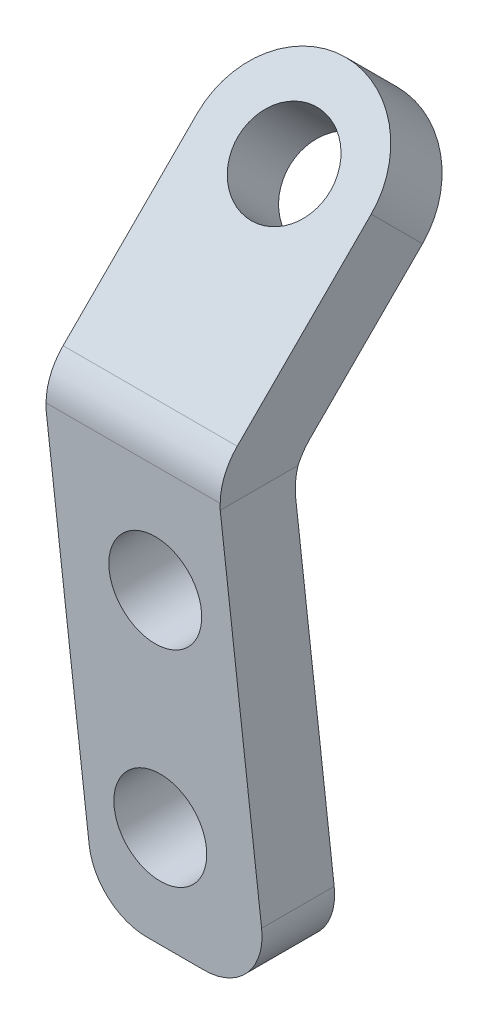
from build123d import *

# Parameters (mm, degrees)
SKETCH_4_R           = 4.196960071
EXTRUDE_3_DEPTH      = 0.6
EXTRUDE_START        = 0.6
SKETCH_5_R           = 4.196960071
EXTRUDE_4_DEPTH      = 0.6
SKETCH_8_R           = 1.6
EXTRUDE_6_DEPTH      = 2.5
SKETCH_9_R           = 27.5
EXTRUDE_7_DEPTH      = 2.5
SKETCH_10_W          = 6
SKETCH_10_H          = 20
CUT_EXTRUDE_1_DEPTH  = 49.812552895
CUT_EXTRUDE_8_DEPTH  = 49.812552895
CUT_EXTRUDE_9_DEPTH  = 6
CUT_EXTRUDE_START    = -31.2
SKETCH_19_R          = 4.196960071
CUT_EXTRUDE_10_DEPTH = 31.2
SKETCH_20_R          = 1.6
CUT_EXTRUDE_11_DEPTH = 40.445330411
FILLET_1_R           = 2


with BuildPart() as part:
    # ｽｹｯﾁ1 → 回転1 (revolve)
    with BuildSketch(Plane(origin=(0, 0, 0), x_dir=(1, 0, 0), z_dir=(0, -0.7071067811865488, 0.7071067811865464)), mode=Mode.PRIVATE) as revolve_1_sk:
        with BuildLine():
            Line((-22.696960071, 15), (-18.5, 15))
            Line((-18.5, 15), (-18.5, -15))
            Line((-18.5, -15), (-22.696960071, -15))
            ThreePointArc((-22.696960071, -15), (-25, 0), (-22.696960071, 15))
        make_face()
    revolve(revolve_1_sk.sketch.rotate(Axis((-18.5, 17.67766953, 17.67766953), (0, -0.7071067811865462, -0.7071067811865488)), 270), axis=Axis((-18.5, 17.67766953, 17.67766953), (0, -0.7071067811865462, -0.7071067811865488)))

    # ｽｹｯﾁ4 → ﾎﾞｽ - 押し出し3 (add)
    with BuildSketch(Plane(origin=(0, -10.606601718, -10.606601718), x_dir=(1, 0, 0), z_dir=(0, -0.7071067811865462, -0.7071067811865488))):
        with Locations(Location((-18.5, 0, 0), (0, 0, 90))):
            Circle(SKETCH_4_R)
    extrude(amount=EXTRUDE_3_DEPTH)

    # ｽｹｯﾁ5 → ﾎﾞｽ - 押し出し4 (add)
    with BuildSketch(Plane(origin=(0, 10.606601718, 10.606601718), x_dir=(1, 0, 0), z_dir=(0, 0.7071067811865462, 0.7071067811865488)).offset(EXTRUDE_START)):
        with Locations(Location((-18.5, 0, 0), (0, 0, 270))):
            Circle(SKETCH_5_R)
    extrude(amount=-EXTRUDE_4_DEPTH)

    # ｽｹｯﾁ8 → ﾎﾞｽ - 押し出し6 (add)
    with BuildSketch(Plane(origin=(0, 11.030865787, 11.030865787), x_dir=(1, 0, 0), z_dir=(0, 0.7071067811865462, 0.7071067811865488))):
        with BuildLine():
            Line((-15.5, -9.999999662), (-21.5, -9.999999662))
            Line((-21.5, -9.999999662), (-21.5, 3.38e-07))
            ThreePointArc((-21.5, 3.38e-07), (-18.5, 3), (-15.5, 3.38e-07))
            Line((-15.5, 3.38e-07), (-15.5, -9.999999662))
        make_face()
        with Locations(Location((-18.5, 0, 0), (0, 0, 270))):
            Circle(SKETCH_8_R, mode=Mode.SUBTRACT)
    extrude(amount=EXTRUDE_6_DEPTH)

    # ｽｹｯﾁ9 → ﾎﾞｽ - 押し出し7 (add)
    with BuildSketch(Plane.XY.offset(18)):
        Circle(SKETCH_9_R)
    extrude(amount=-EXTRUDE_7_DEPTH)

    # ｽｹｯﾁ10 → ｶｯﾄ - 押し出し1 (cut, through all)
    with BuildSketch(Plane(origin=(0, 0, 15.5), x_dir=(-1, 0, 0), z_dir=(0, 0, -1))):
        with Locations((24.5, 0.097265479)):
            Rectangle(SKETCH_10_W, SKETCH_10_H)
    extrude(amount=-CUT_EXTRUDE_1_DEPTH, mode=Mode.SUBTRACT)

    # ｽｹｯﾁ16 → ｶｯﾄ - 押し出し8 (cut, through all)
    with BuildSketch(Plane(origin=(0, 0, 15.5), x_dir=(-1, 0, 0), z_dir=(0, 0, -1))):
        with BuildLine():
            Line((25.579195254, 10.097265479), (15.5, 10.097265479))
            Line((15.5, 10.097265479), (15.5, 22.715633383))
            ThreePointArc((15.5, 22.715633383), (21.486760408, 17.163016261), (25.579195254, 10.097265479))
        make_face()
    extrude(amount=-CUT_EXTRUDE_8_DEPTH, mode=Mode.SUBTRACT)

    # ｽｹｯﾁ17 → ｶｯﾄ - 押し出し9 (cut)
    with BuildSketch(Plane.ZY.offset(21.5)):
        Polygon((15.5, 10.097265479), (18, 10.097265479), (19.869700312, 5.727565167), (18.101933359, 3.959798214), (18, 4.061731573), (18, 7.597265479), align=None)
    extrude(amount=-CUT_EXTRUDE_9_DEPTH, mode=Mode.SUBTRACT)

    # ｽｹｯﾁ19 → ｶｯﾄ - 押し出し10 (cut)
    with BuildSketch(Plane(origin=(0, -11.030865787, -11.030865787), x_dir=(1, 0, 0), z_dir=(0, -0.7071067811865462, -0.7071067811865488)).offset(CUT_EXTRUDE_START)):
        with Locations((-18.5, 0)):
            Circle(SKETCH_19_R)
    extrude(amount=CUT_EXTRUDE_10_DEPTH, mode=Mode.SUBTRACT)


with BuildPart() as body_2:
    # of the pieces the cut leaves, the one that is kept (cut_extrude_10_keep)
    add(part.part.solids().sort_by_distance((-21.5, 6.561731573, 15.5))[0])

    # ｽｹｯﾁ20 → ｶｯﾄ - 押し出し11 (cut, through all)
    with BuildSketch(Plane(origin=(0, 0, 15.5), x_dir=(-1, 0, 0), z_dir=(0, 0, -1))):
        with Locations((17.73769432, 3.061731573)):
            Circle(SKETCH_20_R)
        with Locations((17.564365692, -3.936122183)):
            Circle(SKETCH_20_R)
        with BuildLine():
            Line((21.5, 6.561731573), (19.802086592, -7.435049061))
            Line((19.802086592, -7.435049061), (13.802086592, -7.435049061))
            Line((13.802086592, -7.435049061), (15.5, 6.561731573))
            Line((15.5, 6.561731573), (15.5, 22.715633383))
            ThreePointArc((15.5, 22.715633383), (-26.256917644, -8.174611664), (25.655132995, -9.902734521))
            Line((25.655132995, -9.902734521), (21.5, -9.902734521))
            Line((21.5, -9.902734521), (21.5, 6.561731573))
        make_face()
    extrude(amount=-CUT_EXTRUDE_11_DEPTH, mode=Mode.SUBTRACT)

    # ﾌｨﾚｯﾄ1
    fillet_1_edges = [body_2.edges().sort_by_distance(p)[0] for p in [
        (-18.5, 6.561731573, 15.5),
        (-18.5, 7.597265479, 18),
        (-13.802086592, -7.435049061, 16.75),
        (-19.802086592, -7.435049061, 16.75),
    ]]
    fillet(fillet_1_edges, radius=FILLET_1_R)


solid = body_2.part
